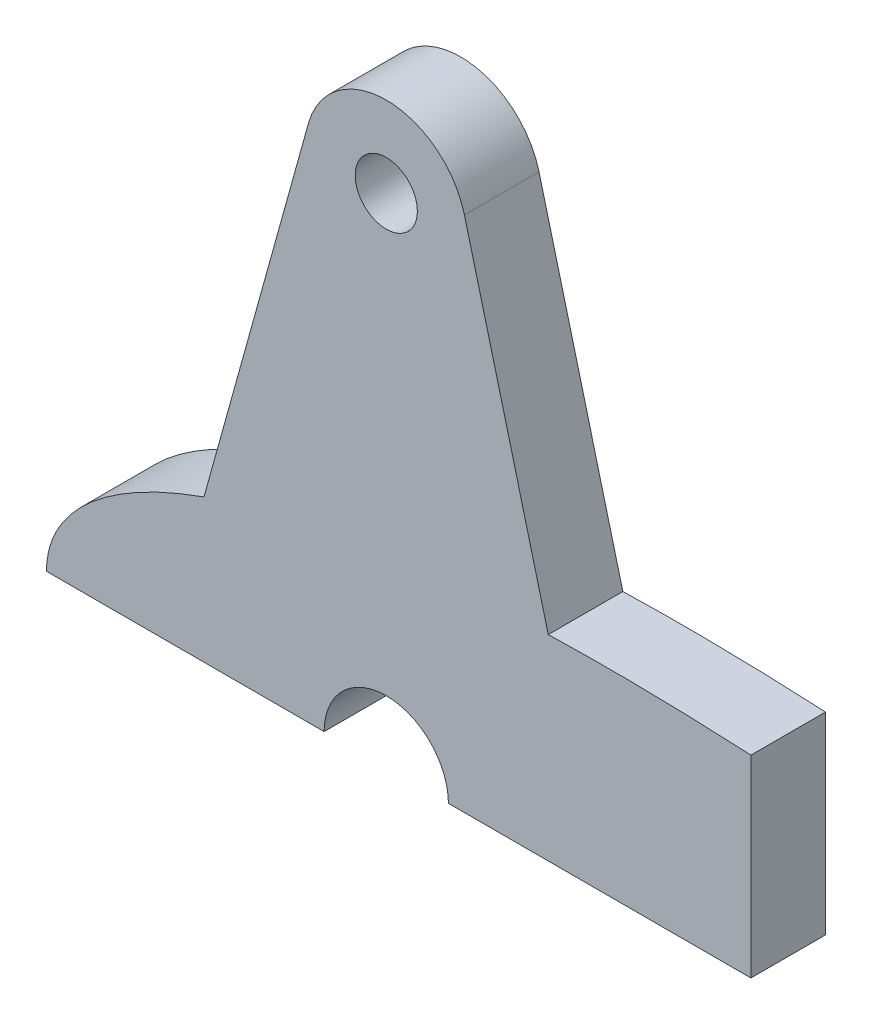
from build123d import *

# Parameters (mm, degrees)
SKETCH2_R           = 1.5875
BOSS_EXTRUDE1_DEPTH = 6.35
SKETCH3_W           = 86.520299057
SKETCH3_H           = 50.752816227
CUT_EXTRUDE1_DEPTH  = 22.86
SCALE1_SCALE        = 2
SKETCH4_W           = 272.729370393
SKETCH4_H           = 354.83187758
CUT_EXTRUDE2_DEPTH  = 5.08


with BuildPart() as part:
    # Sketch2 → Boss-Extrude1 (new body)
    # profile 1 of 3: a face of its own
    with BuildSketch(Plane.XY):
        with BuildLine():
            ThreePointArc((1.670610722, 3.717638474), (6.757246034, 4.420597856), (9.525541119, 0.095721787))
            Line((9.525541119, 0.095721787), (14.182207787, 0.095721787))
            ThreePointArc((14.182207787, 0.095721787), (17.357207787, 3.270721787), (20.532207787, 0.095721787))
            Line((20.532207787, 0.095721787), (35.983874452, 0.095721787))
            Line((35.983874452, 0.095721787), (35.983874452, 4.329055121))
            Line((35.983874452, 4.329055121), (40.217207786, 4.329055121))
            Line((40.217207786, 4.329055121), (40.217207786, 0.095721787))
            Line((40.217207786, 0.095721787), (61.383874452, 0.095721787))
            Line((61.383874452, 0.095721787), (61.383874452, 3.270721787))
            Line((61.383874452, 3.270721787), (65.617207786, 3.270721787))
            Line((65.617207786, 3.270721787), (65.617207786, 0.095721787))
            Line((65.617207786, 0.095721787), (103.86369276, 0.095721787))
            ThreePointArc((103.86369276, 0.095721787), (103.701399804, 0.51971831), (103.297478426, 0.726985228))
            add(Edge.make_bspline(
                [(103.297478426, 0.726985228), (103.278401428, 0.729063962), (102.555454876, 0.807955214), (101.062938142, 0.9797924), (98.757762781, 1.268659765), (96.264687204, 1.604159637), (93.594492647, 1.985539835), (90.758742018, 2.410830368), (87.769477293, 2.877005798), (84.639221741, 3.37990378), (81.380911453, 3.914330069), (78.007857734, 4.474123419), (74.533703974, 5.052218069), (70.972402786, 5.640770262), (67.338193058, 6.231252409), (63.64558795, 6.814592878), (59.909367026, 7.381298257), (56.144575667, 7.921621871), (52.366523305, 8.42568744), (48.590787146, 8.883665117), (44.833214748, 9.285912766), (41.109926451, 9.623146231), (37.437313832, 9.88657477), (33.832039387, 10.068065432), (30.311032911, 10.16029608), (27.586882733, 10.157568276), (26.039008587, 10.123270788), (25.632313035, 10.111855728)],
                knots=[0.036532984, 0.036532984, 0.036532984, 0.036532984, 0.036780684, 0.045920102, 0.055931764, 0.066772884, 0.07839713, 0.090754827, 0.103793165, 0.117456432, 0.131686226, 0.146421738, 0.161599998, 0.177156133, 0.193023668, 0.209134786, 0.225420633, 0.241811602, 0.258237647, 0.274628557, 0.290914287, 0.307025229, 0.322892517, 0.338448342, 0.353626207, 0.368361232, 0.373613721, 0.373613721, 0.373613721, 0.373613721], degree=3))
            add(Edge.make_bspline(
                [(25.632313035, 10.111855728), (24.937254507, 10.092346946), (23.184818676, 10.025451452), (20.426871455, 9.842671724), (17.41757594, 9.524763014), (14.581362978, 9.097201986), (11.937145196, 8.559838657), (9.777339551, 7.98685794), (8.50999095, 7.572117066), (8.045152998, 7.406999756)],
                knots=[0.373613721, 0.373613721, 0.373613721, 0.373613721, 0.382590428, 0.396252961, 0.409290412, 0.42164701, 0.433269881, 0.444109249, 0.450476502, 0.450476502, 0.450476502, 0.450476502], degree=3))
            add(Edge.make_bspline(
                [(8.045152998, 7.406999756), (7.779260681, 7.312550875), (6.851122091, 6.967807185), (5.357476635, 6.31774957), (3.688721993, 5.384292388), (2.487404704, 4.50418497), (1.86787348, 3.922488633), (1.670610722, 3.717638474)],
                knots=[0.450476502, 0.450476502, 0.450476502, 0.450476502, 0.45411864, 0.463255055, 0.471479114, 0.478755289, 0.482422896, 0.482422896, 0.482422896, 0.482422896], degree=3))
        make_face()
    # profile 2 of 3: a face of its own
    with BuildSketch(Plane.XY):
        with BuildLine():
            Line((0.000541119, 0.095721787), (9.525541119, 0.095721787))
            ThreePointArc((9.525541119, 0.095721787), (6.757246034, 4.420597856), (1.670610722, 3.717638474))
            add(Edge.make_bspline(
                [(1.670610722, 3.717638474), (1.529186884, 3.570774992), (1.119191891, 3.11301165), (0.577729932, 2.332445287), (0.184929806, 1.416285372), (0.02630969, 0.681353971), (0.000541119, 0.263637648), (0.000541119, 0.095721787)],
                knots=[0.482422896, 0.482422896, 0.482422896, 0.482422896, 0.485052318, 0.490344026, 0.494609833, 0.497833231, 0.5, 0.5, 0.5, 0.5], degree=3))
        make_face()
    # profile 3 of 3: a face of its own
    with BuildSketch(Plane.XY):
        with BuildLine():
            Line((13.380481545, 26.601119745), (8.045152998, 7.406999756))
            add(Edge.make_bspline(
                [(25.632313035, 10.111855728), (24.937254507, 10.092346946), (23.184818676, 10.025451452), (20.426871455, 9.842671724), (17.41757594, 9.524763014), (14.581362978, 9.097201986), (11.937145196, 8.559838657), (9.777339551, 7.98685794), (8.50999095, 7.572117066), (8.045152998, 7.406999756)],
                knots=[0.373613721, 0.373613721, 0.373613721, 0.373613721, 0.382590428, 0.396252961, 0.409290412, 0.42164701, 0.433269881, 0.444109249, 0.450476502, 0.450476502, 0.450476502, 0.450476502], degree=3))
            Line((25.632313035, 10.111855728), (21.351268338, 26.536748478))
            ThreePointArc((21.351268338, 26.536748478), (17.390539973, 29.623087196), (13.380481545, 26.601119745))
        make_face()
        with Locations((17.357207787, 25.495721787)):
            Circle(SKETCH2_R, mode=Mode.SUBTRACT)
    extrude(amount=BOSS_EXTRUDE1_DEPTH)

    # Sketch3 → Cut-Extrude1 (cut)
    with BuildSketch(Plane.XY.offset(6.35)):
        with Locations((79.244023981, 18.591780176)):
            Rectangle(SKETCH3_W, SKETCH3_H)
    extrude(amount=-CUT_EXTRUDE1_DEPTH, mode=Mode.SUBTRACT)


with BuildPart() as part_1:
    # Scale1: scaled about (18.859528884, 10.342075023, 3.175)
    add(part.part.scale(SCALE1_SCALE).moved(Location((-18.859528884, -10.342075023, -3.175))))

    # Sketch4 → Cut-Extrude2 (cut)
    with BuildSketch(Plane.XY.offset(9.525000538)):
        with Locations((12.859074943, 7.536544166)):
            Rectangle(SKETCH4_W, SKETCH4_H)
    extrude(amount=-CUT_EXTRUDE2_DEPTH, mode=Mode.SUBTRACT)


solid = part_1.part
